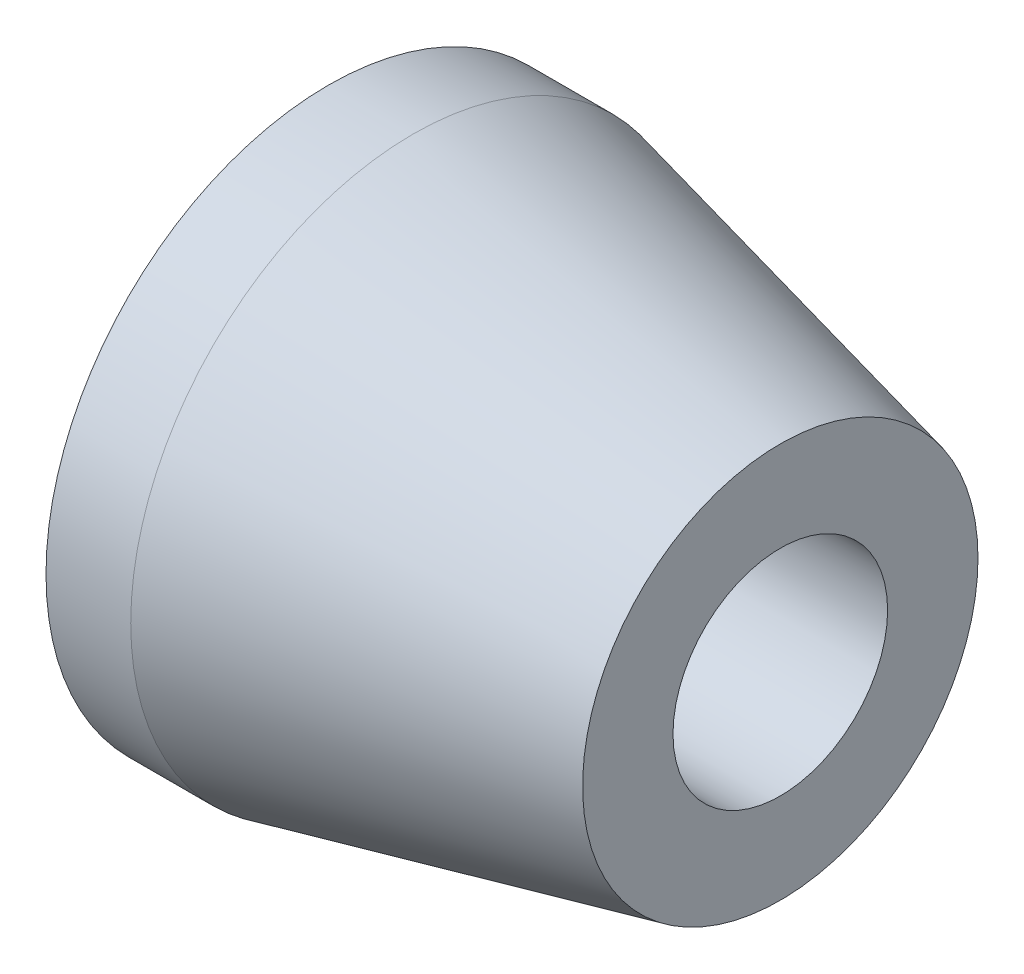
from build123d import *


with BuildPart() as part:
    # Sketch1 → Revolve1 (revolve)
    with BuildSketch(Plane.XY, mode=Mode.PRIVATE) as revolve1_sk:
        Polygon((0, 3.8), (-14, 3.8), (-14, 5.5), (-16, 5.5), (-16, 10), (-13, 10), (0, 7), align=None)
    revolve(revolve1_sk.sketch.rotate(Axis((0, 0, 0), (-1, 0, 0)), 90), axis=Axis((0, 0, 0), (-1, 0, 0)))


solid = part.part
